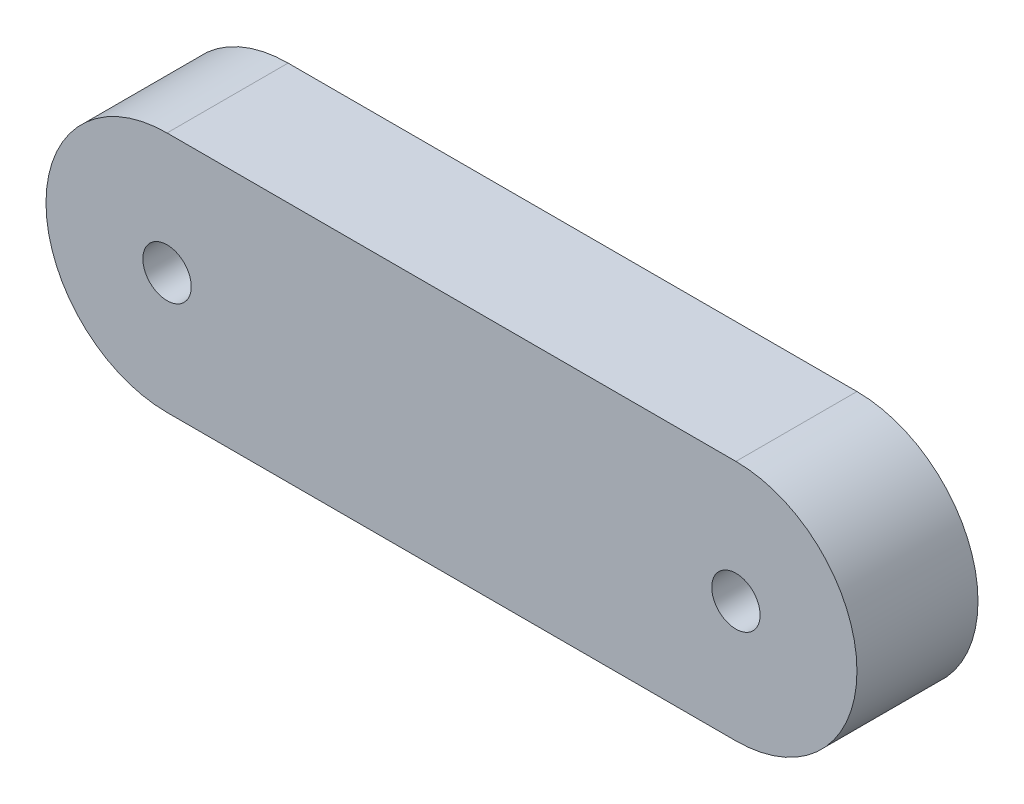
from build123d import *

# Parameters (mm, degrees)
SKETCH1_R           = 2
BOSS_EXTRUDE1_DEPTH = 10


with BuildPart() as part:
    # Sketch1 → Boss-Extrude1 (new body)
    with BuildSketch(Plane.XY):
        with BuildLine():
            Line((-146.232830821, -2.495812395), (-193.232830821, -2.495812395))
            ThreePointArc((-193.232830821, -2.495812395), (-203.232830821, 7.504187605), (-193.232830821, 17.504187605))
            Line((-193.232830821, 17.504187605), (-146.232830821, 17.504187605))
            ThreePointArc((-146.232830821, 17.504187605), (-136.232830821, 7.504187605), (-146.232830821, -2.495812395))
        make_face()
        with Locations((-193.232830821, 7.504187605)):
            Circle(SKETCH1_R, mode=Mode.SUBTRACT)
        with Locations((-146.232830821, 7.504187605)):
            Circle(SKETCH1_R, mode=Mode.SUBTRACT)
    extrude(amount=BOSS_EXTRUDE1_DEPTH)


solid = part.part
